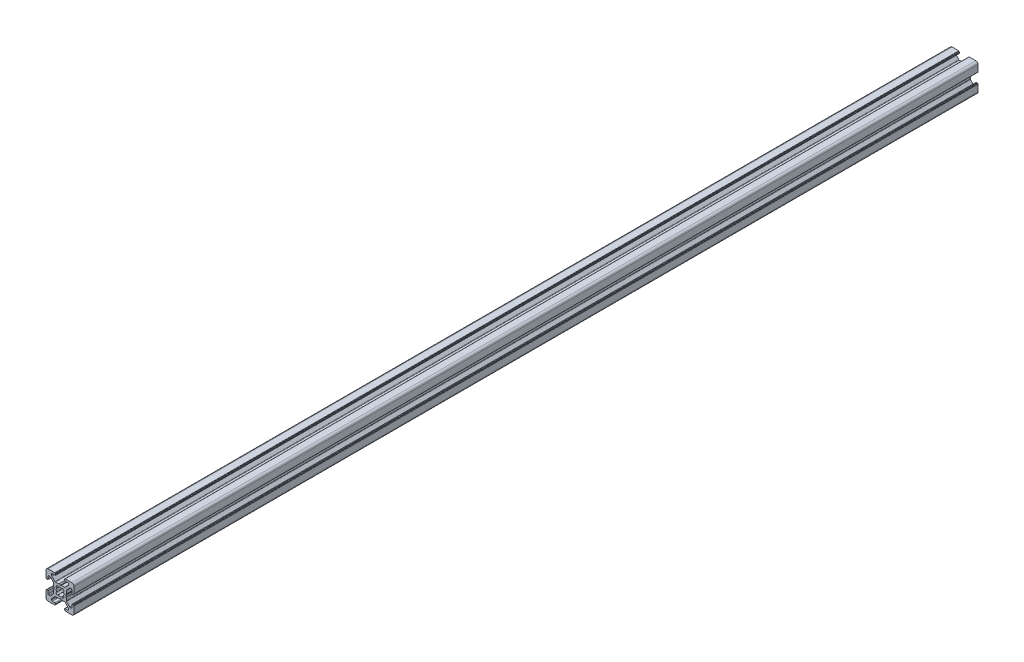
from build123d import *

# Parameters (mm, degrees)
EXTRUDE_580_DEPTH = 322.5


with BuildPart() as part:
    # Model → Extrude 580 (new, symmetric)
    with BuildSketch(Plane.XY):
        with BuildLine():
            Line((5.657855418, 4.59719506), (5.709619227, 4.790380225))
            Line((5.709619227, 4.790380225), (5.902804392, 4.842144034))
            Line((5.902804392, 4.842144034), (6.914213353, 5.853552995))
            ThreePointArc((6.914213353, 5.853552995), (7.076425027, 5.961939371), (7.267766744, 5.999999605))
            Line((7.267766744, 5.999999605), (7.999999732, 5.999999605))
            ThreePointArc((7.999999732, 5.999999605), (8.353553123, 5.853552995), (8.499999732, 5.499999605))
            Line((8.499999732, 5.499999605), (8.499999732, 3.6))
            ThreePointArc((8.499999732, 3.6), (8.646446341, 3.246446609), (8.999999732, 3.1))
            Line((8.999999732, 3.1), (9.300000059, 3.1))
            ThreePointArc((9.300000059, 3.1), (9.441421415, 3.158578644), (9.500000059, 3.3))
            Line((9.500000059, 3.3), (9.500000059, 3.350000228))
            ThreePointArc((9.500000059, 3.350000228), (9.558578702, 3.491421584), (9.700000059, 3.550000228))
            Line((9.700000059, 3.550000228), (9.800000059, 3.550000228))
            ThreePointArc((9.800000059, 3.550000228), (9.941421377, 3.608578892), (10, 3.750000228))
            Line((10, 3.750000228), (10, 8.5))
            ThreePointArc((10, 8.5), (9.560660172, 9.560660172), (8.5, 10))
            Line((8.5, 10), (3.750000228, 10))
            ThreePointArc((3.750000228, 10), (3.608578871, 9.941421356), (3.550000228, 9.8))
            Line((3.550000228, 9.8), (3.550000228, 9.7))
            ThreePointArc((3.550000228, 9.7), (3.491421584, 9.558578644), (3.350000228, 9.5))
            Line((3.350000228, 9.5), (3.3, 9.5))
            ThreePointArc((3.3, 9.5), (3.158578644, 9.441421356), (3.1, 9.3))
            Line((3.1, 9.3), (3.1, 8.999999673))
            ThreePointArc((3.1, 8.999999673), (3.246446609, 8.646446283), (3.6, 8.499999673))
            Line((3.6, 8.499999673), (5.500000686, 8.499999673))
            ThreePointArc((5.500000686, 8.499999673), (5.853554077, 8.353553064), (6.000000686, 7.999999673))
            Line((6.000000686, 7.999999673), (6.000000686, 7.267766626))
            ThreePointArc((6.000000686, 7.267766626), (5.961940448, 7.076424899), (5.853554059, 6.914213219))
            Line((5.853554059, 6.914213219), (3.585787212, 4.646446592))
            ThreePointArc((3.585787212, 4.646446592), (3.423575544, 4.538060229), (3.232233839, 4.5))
            Line((3.232233839, 4.5), (0.953590312, 4.5))
            ThreePointArc((0.953590312, 4.5), (0.901826505, 4.493185166), (0.853590316, 4.473205083))
            Line((0.853590316, 4.473205083), (0.100000045, 4.038119562))
            ThreePointArc((0.100000045, 4.038119562), (0, 4.011324632), (-0.100000045, 4.038119562))
            Line((-0.100000045, 4.038119562), (-0.853590316, 4.473205083))
            ThreePointArc((-0.853590316, 4.473205083), (-0.901826505, 4.493185166), (-0.953590312, 4.5))
            Line((-0.953590312, 4.5), (-3.232233839, 4.5))
            ThreePointArc((-3.232233839, 4.5), (-3.423575544, 4.538060229), (-3.585787212, 4.646446592))
            Line((-3.585787212, 4.646446592), (-5.853554059, 6.914213219))
            ThreePointArc((-5.853554059, 6.914213219), (-5.961940448, 7.076424899), (-6.000000686, 7.267766626))
            Line((-6.000000686, 7.267766626), (-6.000000686, 7.999999673))
            ThreePointArc((-6.000000686, 7.999999673), (-5.853554077, 8.353553064), (-5.500000686, 8.499999673))
            Line((-5.500000686, 8.499999673), (-3.6, 8.499999673))
            ThreePointArc((-3.6, 8.499999673), (-3.246446609, 8.646446283), (-3.1, 8.999999673))
            Line((-3.1, 8.999999673), (-3.1, 9.3))
            ThreePointArc((-3.1, 9.3), (-3.158578644, 9.441421356), (-3.3, 9.5))
            Line((-3.3, 9.5), (-3.350000228, 9.5))
            ThreePointArc((-3.350000228, 9.5), (-3.491421584, 9.558578644), (-3.550000228, 9.7))
            Line((-3.550000228, 9.7), (-3.550000228, 9.8))
            ThreePointArc((-3.550000228, 9.8), (-3.608578871, 9.941421356), (-3.750000228, 10))
            Line((-3.750000228, 10), (-8.5, 10))
            ThreePointArc((-8.5, 10), (-9.560660172, 9.560660172), (-10, 8.5))
            Line((-10, 8.5), (-10, 3.750000228))
            ThreePointArc((-10, 3.750000228), (-9.941421356, 3.608578871), (-9.8, 3.550000228))
            Line((-9.8, 3.550000228), (-9.7, 3.550000228))
            ThreePointArc((-9.7, 3.550000228), (-9.558578644, 3.491421584), (-9.5, 3.350000228))
            Line((-9.5, 3.350000228), (-9.5, 3.3))
            ThreePointArc((-9.5, 3.3), (-9.441421356, 3.158578644), (-9.3, 3.1))
            Line((-9.3, 3.1), (-8.999999673, 3.1))
            ThreePointArc((-8.999999673, 3.1), (-8.646446283, 3.246446609), (-8.499999673, 3.6))
            Line((-8.499999673, 3.6), (-8.499999673, 5.499999605))
            ThreePointArc((-8.499999673, 5.499999605), (-8.353553064, 5.853552995), (-7.999999673, 5.999999605))
            Line((-7.999999673, 5.999999605), (-7.267766626, 5.999999605))
            ThreePointArc((-7.267766626, 5.999999605), (-7.07642491, 5.961939371), (-6.914213236, 5.853552995))
            Line((-6.914213236, 5.853552995), (-4.64644634, 3.585786099))
            ThreePointArc((-4.64644634, 3.585786099), (-4.538059964, 3.423574425), (-4.49999973, 3.232232708))
            Line((-4.49999973, 3.232232708), (-4.49999973, 0.953589302))
            ThreePointArc((-4.49999973, 0.953589302), (-4.493184895, 0.90182549), (-4.473204808, 0.853589297))
            Line((-4.473204808, 0.853589297), (-4.038119782, 0.099999969))
            ThreePointArc((-4.038119782, 0.099999969), (-4.01132487, 0), (-4.038119782, -0.099999969))
            Line((-4.038119782, -0.099999969), (-4.473204808, -0.853589297))
            ThreePointArc((-4.473204808, -0.853589297), (-4.493184895, -0.90182549), (-4.49999973, -0.953589302))
            Line((-4.49999973, -0.953589302), (-4.49999973, -3.232232708))
            ThreePointArc((-4.49999973, -3.232232708), (-4.538059964, -3.423574425), (-4.64644634, -3.585786099))
            Line((-4.64644634, -3.585786099), (-6.914213236, -5.853552995))
            ThreePointArc((-6.914213236, -5.853552995), (-7.07642491, -5.961939371), (-7.267766626, -5.999999605))
            Line((-7.267766626, -5.999999605), (-7.999999615, -5.999999605))
            ThreePointArc((-7.999999615, -5.999999605), (-8.353553005, -5.853552995), (-8.499999615, -5.499999605))
            Line((-8.499999615, -5.499999605), (-8.499999615, -3.6))
            ThreePointArc((-8.499999615, -3.6), (-8.646446224, -3.246446609), (-8.999999615, -3.1))
            Line((-8.999999615, -3.1), (-9.299999941, -3.1))
            ThreePointArc((-9.299999941, -3.1), (-9.441421298, -3.158578644), (-9.499999941, -3.3))
            Line((-9.499999941, -3.3), (-9.499999941, -3.350000228))
            ThreePointArc((-9.499999941, -3.350000228), (-9.558578585, -3.491421584), (-9.699999941, -3.550000228))
            Line((-9.699999941, -3.550000228), (-9.799999941, -3.550000228))
            ThreePointArc((-9.799999941, -3.550000228), (-9.941421298, -3.608578871), (-9.999999941, -3.750000228))
            Line((-9.999999941, -3.750000228), (-9.999999941, -8.5))
            ThreePointArc((-9.999999941, -8.5), (-9.560660113, -9.560660172), (-8.499999941, -10))
            Line((-8.499999941, -10), (-3.750000169, -10))
            ThreePointArc((-3.750000169, -10), (-3.608578813, -9.941421356), (-3.550000169, -9.8))
            Line((-3.550000169, -9.8), (-3.550000169, -9.7))
            ThreePointArc((-3.550000169, -9.7), (-3.491421525, -9.558578644), (-3.350000169, -9.5))
            Line((-3.350000169, -9.5), (-3.299999941, -9.5))
            ThreePointArc((-3.299999941, -9.5), (-3.158578585, -9.441421356), (-3.099999941, -9.3))
            Line((-3.099999941, -9.3), (-3.099999941, -8.999999673))
            ThreePointArc((-3.099999941, -8.999999673), (-3.246446551, -8.646446283), (-3.599999941, -8.499999673))
            Line((-3.599999941, -8.499999673), (-5.500000627, -8.499999673))
            ThreePointArc((-5.500000627, -8.499999673), (-5.853554018, -8.353553064), (-6.000000627, -7.999999673))
            Line((-6.000000627, -7.999999673), (-6.000000627, -7.267766626))
            ThreePointArc((-6.000000627, -7.267766626), (-5.961940389, -7.076424899), (-5.853554001, -6.914213219))
            Line((-5.853554001, -6.914213219), (-3.585787153, -4.646446592))
            ThreePointArc((-3.585787153, -4.646446592), (-3.423575485, -4.538060229), (-3.23223378, -4.5))
            Line((-3.23223378, -4.5), (-0.953590253, -4.5))
            ThreePointArc((-0.953590253, -4.5), (-0.901826446, -4.493185166), (-0.853590257, -4.473205083))
            Line((-0.853590257, -4.473205083), (-0.099999986, -4.038119562))
            ThreePointArc((-0.099999986, -4.038119562), (5.9e-08, -4.011324632), (0.100000103, -4.038119562))
            Line((0.100000103, -4.038119562), (0.853590375, -4.473205083))
            ThreePointArc((0.853590375, -4.473205083), (0.901826564, -4.493185166), (0.95359037, -4.5))
            Line((0.95359037, -4.5), (3.232233897, -4.5))
            ThreePointArc((3.232233897, -4.5), (3.423575602, -4.538060229), (3.585787271, -4.646446592))
            Line((3.585787271, -4.646446592), (5.853554118, -6.914213219))
            ThreePointArc((5.853554118, -6.914213219), (5.961940506, -7.076424899), (6.000000745, -7.267766626))
            Line((6.000000745, -7.267766626), (6.000000745, -7.999999673))
            ThreePointArc((6.000000745, -7.999999673), (5.853554135, -8.353553064), (5.500000745, -8.499999673))
            Line((5.500000745, -8.499999673), (3.600000059, -8.499999673))
            ThreePointArc((3.600000059, -8.499999673), (3.246446668, -8.646446283), (3.100000059, -8.999999673))
            Line((3.100000059, -8.999999673), (3.100000059, -9.3))
            ThreePointArc((3.100000059, -9.3), (3.158578702, -9.441421356), (3.300000059, -9.5))
            Line((3.300000059, -9.5), (3.350000286, -9.5))
            ThreePointArc((3.350000286, -9.5), (3.491421642, -9.558578644), (3.550000286, -9.7))
            Line((3.550000286, -9.7), (3.550000286, -9.8))
            ThreePointArc((3.550000286, -9.8), (3.60857893, -9.941421356), (3.750000286, -10))
            Line((3.750000286, -10), (8.500000059, -10))
            ThreePointArc((8.500000059, -10), (9.56066023, -9.560660172), (10.000000059, -8.5))
            Line((10.000000059, -8.5), (10.000000059, -3.750000228))
            ThreePointArc((10.000000059, -3.750000228), (9.941421415, -3.608578871), (9.800000059, -3.550000228))
            Line((9.800000059, -3.550000228), (9.700000059, -3.550000228))
            ThreePointArc((9.700000059, -3.550000228), (9.558578702, -3.491421584), (9.500000059, -3.350000228))
            Line((9.500000059, -3.350000228), (9.500000059, -3.3))
            ThreePointArc((9.500000059, -3.3), (9.441421415, -3.158578644), (9.300000059, -3.1))
            Line((9.300000059, -3.1), (8.999999732, -3.1))
            ThreePointArc((8.999999732, -3.1), (8.646446341, -3.246446609), (8.499999732, -3.6))
            Line((8.499999732, -3.6), (8.499999732, -5.499999697))
            ThreePointArc((8.499999732, -5.499999697), (8.353553138, -5.853553034), (7.999999791, -5.999999605))
            Line((7.999999791, -5.999999605), (7.267766744, -5.999999605))
            ThreePointArc((7.267766744, -5.999999605), (7.076425027, -5.961939371), (6.914213353, -5.853552995))
            Line((6.914213353, -5.853552995), (4.646446457, -3.585786099))
            ThreePointArc((4.646446457, -3.585786099), (4.538060081, -3.423574425), (4.499999847, -3.232232708))
            Line((4.499999847, -3.232232708), (4.499999847, -0.953589302))
            ThreePointArc((4.499999847, -0.953589302), (4.493185012, -0.90182549), (4.473204926, -0.853589297))
            Line((4.473204926, -0.853589297), (4.0381199, -0.099999969))
            ThreePointArc((4.0381199, -0.099999969), (4.011324987, 0), (4.0381199, 0.099999969))
            Line((4.0381199, 0.099999969), (4.473204926, 0.853589297))
            ThreePointArc((4.473204926, 0.853589297), (4.493185012, 0.90182549), (4.499999847, 0.953589302))
            Line((4.499999847, 0.953589302), (4.499999847, 3.232232708))
            ThreePointArc((4.499999847, 3.232232708), (4.538060081, 3.423574425), (4.646446457, 3.585786099))
            Line((4.646446457, 3.585786099), (5.657855418, 4.59719506))
        make_face()
        with BuildLine():
            Line((-1.91389502, 2.989640962), (-1.258185436, 2.445295362))
            ThreePointArc((-1.258185436, 2.445295362), (0, 2.75), (1.258185436, 2.445295362))
            Line((1.258185436, 2.445295362), (1.91389502, 2.989640962))
            ThreePointArc((1.91389502, 2.989640962), (2.511737261, 2.508410485), (2.992174953, 1.909930962))
            Line((2.992174953, 1.909930962), (2.445295423, 1.258185317))
            ThreePointArc((2.445295423, 1.258185317), (2.75, 0), (2.445295423, -1.258185317))
            Line((2.445295423, -1.258185317), (2.992174953, -1.909930962))
            ThreePointArc((2.992174953, -1.909930962), (2.511737261, -2.508410485), (1.91389502, -2.989640962))
            Line((1.91389502, -2.989640962), (1.258185436, -2.445295362))
            ThreePointArc((1.258185436, -2.445295362), (0, -2.75), (-1.258185436, -2.445295362))
            Line((-1.258185436, -2.445295362), (-1.91389502, -2.989640962))
            ThreePointArc((-1.91389502, -2.989640962), (-2.511737261, -2.508410485), (-2.992174953, -1.909930962))
            Line((-2.992174953, -1.909930962), (-2.445295423, -1.258185317))
            ThreePointArc((-2.445295423, -1.258185317), (-2.75, 0), (-2.445295423, 1.258185317))
            Line((-2.445295423, 1.258185317), (-2.992174953, 1.909930962))
            ThreePointArc((-2.992174953, 1.909930962), (-2.511737261, 2.508410485), (-1.91389502, 2.989640962))
        make_face(mode=Mode.SUBTRACT)
    extrude(amount=EXTRUDE_580_DEPTH, both=True)


solid = part.part
